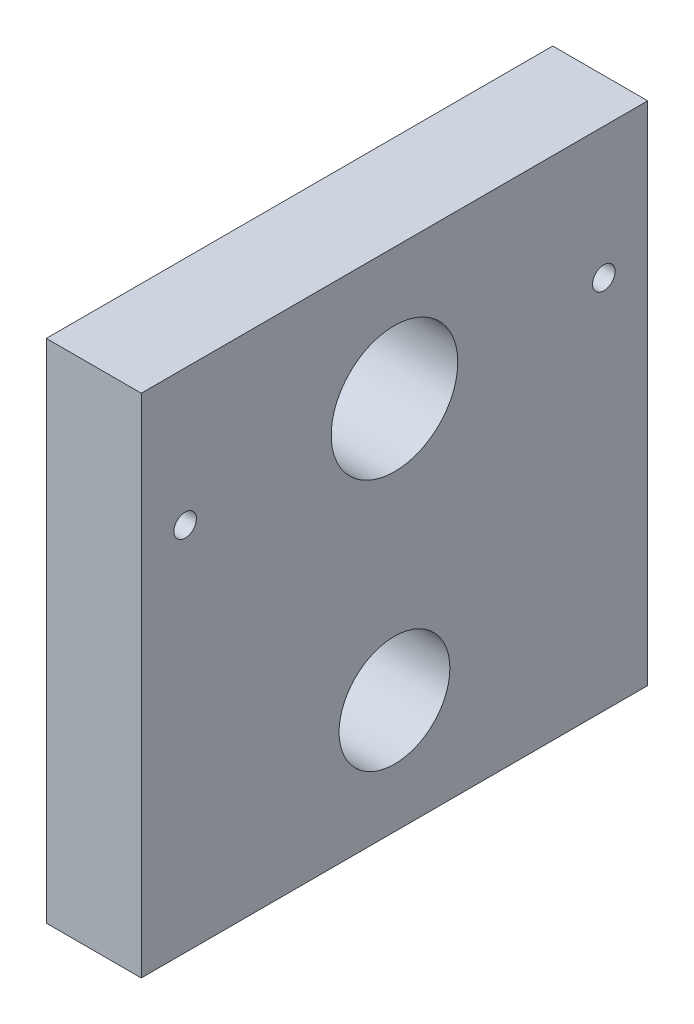
from build123d import *

# Parameters (mm, degrees)
SKETCH1_W                          = 50.8
SKETCH1_H                          = 50.8
BOSS_EXTRUDE1_DEPTH                = 9.525
F_7_16_0_4375_DIAMETER_HOLE1_D     = 11.1125
F_7_16_0_4375_DIAMETER_HOLE1_DEPTH = 70.104
F_7_16_0_4375_DIAMETER_HOLE1_TIP   = 3.338531814
F_1_2_0_5_DIAMETER_HOLE2_D         = 12.7
F_1_2_0_5_DIAMETER_HOLE2_DEPTH     = 70.104
F_1_2_0_5_DIAMETER_HOLE2_TIP       = 3.815464931
F_4_40_TAPPED_HOLE1_D              = 2.2606
F_10_32_TAPPED_HOLE1_D             = 4.0386
F_10_32_TAPPED_HOLE1_DEPTH         = 11.938
F_10_32_TAPPED_HOLE1_TIP           = 1.213317848


with BuildPart() as part:
    # Sketch1 → Boss-Extrude1 (new body)
    with BuildSketch(Plane(origin=(0, 0, 0), x_dir=(0, 0, -1), z_dir=(1, 0, 0))):
        Rectangle(SKETCH1_W, SKETCH1_H)
    extrude(amount=BOSS_EXTRUDE1_DEPTH)

    # 7/16 (0.4375) Diameter Hole1
    with Locations(Plane(origin=(9.525, 0, 0), x_dir=(0, 0, -1), z_dir=(1, 0, 0))):
        with Locations((0, -13.97)):
            Hole(F_7_16_0_4375_DIAMETER_HOLE1_D / 2, depth=F_7_16_0_4375_DIAMETER_HOLE1_DEPTH)
            with Locations((0, 0, -(F_7_16_0_4375_DIAMETER_HOLE1_DEPTH + F_7_16_0_4375_DIAMETER_HOLE1_TIP / 2))):  # 118° drill point
                Cone(0, F_7_16_0_4375_DIAMETER_HOLE1_D / 2, F_7_16_0_4375_DIAMETER_HOLE1_TIP, mode=Mode.SUBTRACT)

    # 1/2 (0.5) Diameter Hole2
    with Locations(Plane(origin=(9.525, 0, 0), x_dir=(0, 0, -1), z_dir=(1, 0, 0))):
        with Locations((0, 12.2301)):
            Hole(F_1_2_0_5_DIAMETER_HOLE2_D / 2, depth=F_1_2_0_5_DIAMETER_HOLE2_DEPTH)
            with Locations((0, 0, -(F_1_2_0_5_DIAMETER_HOLE2_DEPTH + F_1_2_0_5_DIAMETER_HOLE2_TIP / 2))):  # 118° drill point
                Cone(0, F_1_2_0_5_DIAMETER_HOLE2_D / 2, F_1_2_0_5_DIAMETER_HOLE2_TIP, mode=Mode.SUBTRACT)

    # #4-40 Tapped Hole1 (through all)
    with Locations(Plane(origin=(9.525, 0, 0), x_dir=(0, 0, -1), z_dir=(1, 0, 0))):
        with Locations((21, 12.2301), (-21, 11.74145915)):
            Hole(F_4_40_TAPPED_HOLE1_D / 2)

    # #10-32 Tapped Hole1
    with Locations(Plane(origin=(-0.669296778, 7.980106856, -25.4), x_dir=(-1, 0, 0), z_dir=(0, 0, -1))):
        with Locations((-5.431796778, -27.030106856), (-5.431796778, 11.069893144)):
            Hole(F_10_32_TAPPED_HOLE1_D / 2, depth=F_10_32_TAPPED_HOLE1_DEPTH)
            with Locations((0, 0, -(F_10_32_TAPPED_HOLE1_DEPTH + F_10_32_TAPPED_HOLE1_TIP / 2))):  # 118° drill point
                Cone(0, F_10_32_TAPPED_HOLE1_D / 2, F_10_32_TAPPED_HOLE1_TIP, mode=Mode.SUBTRACT)


solid = part.part
